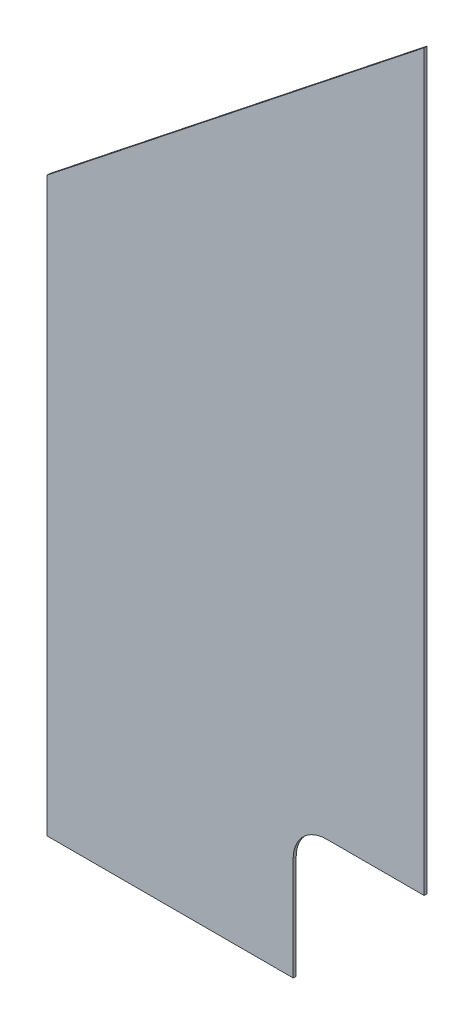
from build123d import *

# Parameters (mm, degrees)
BOSS_EXTRUDE1_DEPTH = 3.175
CUT_EXTRUDE3_DEPTH  = 991.548705854


with BuildPart() as part:
    # Sketch1 → Boss-Extrude1 (new body)
    with BuildSketch(Plane.XY):
        Polygon((0, 0), (-393.7, 0), (-393.7, 596.9), (0, 908.942774901), align=None)
    extrude(amount=BOSS_EXTRUDE1_DEPTH)

    # Sketch4 → Cut-Extrude3 (cut, through all)
    with BuildSketch(Plane.XY.offset(3.175)):
        with BuildLine():
            Line((0, 0), (-136.652, 0))
            Line((-136.652, 0), (-136.652, 107.95))
            ThreePointArc((-136.652, 107.95), (-126.422704333, 132.645704333), (-101.727, 142.875))
            Line((-101.727, 142.875), (0, 142.875))
            Line((0, 142.875), (0, 0))
        make_face()
    extrude(amount=-CUT_EXTRUDE3_DEPTH, mode=Mode.SUBTRACT)


solid = part.part
